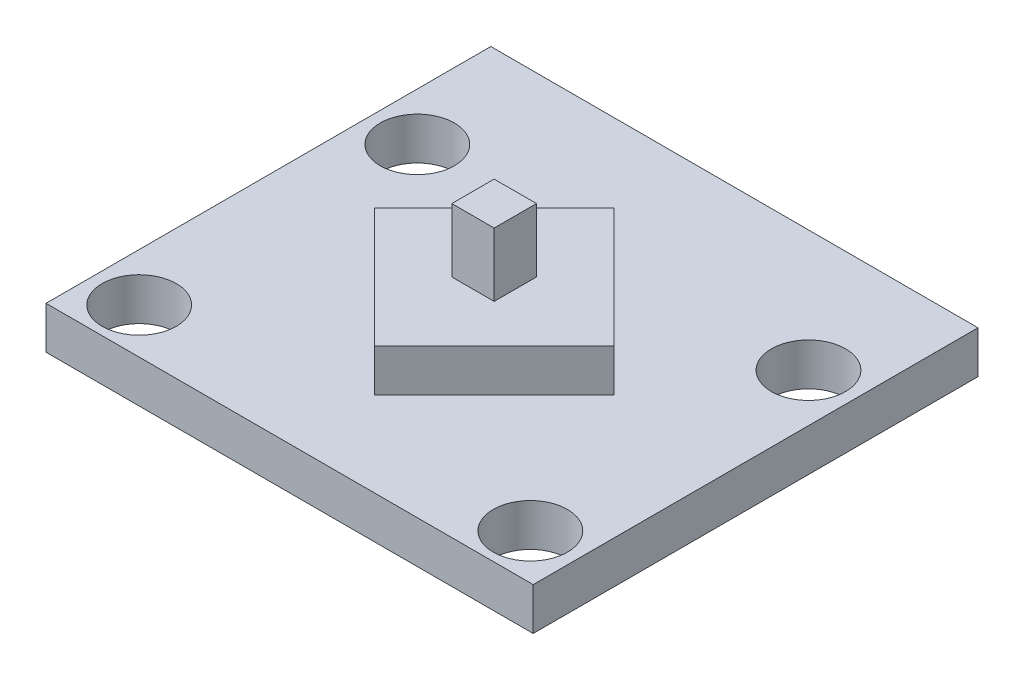
from build123d import *

# Parameters (mm, degrees)
SKETCH1_W           = 23
SKETCH1_H           = 21
BOSS_EXTRUDE1_DEPTH = 2
SKETCH2_R           = 1.75
CUT_EXTRUDE1_DEPTH  = 16.700318468
BOSS_EXTRUDE2_DEPTH = 2
SKETCH4_W           = 2
SKETCH4_H           = 2
BOSS_EXTRUDE3_DEPTH = 3


with BuildPart() as part:
    # Sketch1 → Boss-Extrude1 (new body)
    with BuildSketch(Plane(origin=(0, 0, 0), x_dir=(1, 0, 0), z_dir=(0, 1, 0))):
        Rectangle(SKETCH1_W, SKETCH1_H)
    extrude(amount=BOSS_EXTRUDE1_DEPTH)

    # Sketch2 → Cut-Extrude1 (cut, through all)
    with BuildSketch(Plane(origin=(0, 2, 0), x_dir=(1, 0, 0), z_dir=(0, 1, 0))):
        with Locations(Location((-9.233302989, -8.367680834, 0), (0, 0, 270))):
            Circle(SKETCH2_R)
        with Locations(Location((9.233302989, -8.367680834, 0), (0, 0, 270))):
            Circle(SKETCH2_R)
        with Locations(Location((9.233302989, 4.764127862, 0), (0, 0, 270))):
            Circle(SKETCH2_R)
        with Locations(Location((-9.233302989, 4.764127862, 0), (0, 0, 270))):
            Circle(SKETCH2_R)
    extrude(amount=-CUT_EXTRUDE1_DEPTH, mode=Mode.SUBTRACT)

    # Sketch3 → Boss-Extrude2 (add)
    with BuildSketch(Plane(origin=(0, 2, 0), x_dir=(1, 0, 0), z_dir=(0, 1, 0))):
        Polygon((-5.656854249, -0.843145751), (0, -6.5), (5.656854249, -0.843145751), (0, 4.813708499), align=None)
    extrude(amount=BOSS_EXTRUDE2_DEPTH)

    # Sketch4 → Boss-Extrude3 (add)
    with BuildSketch(Plane(origin=(0, 4, 0), x_dir=(1, 0, 0), z_dir=(0, 1, 0))):
        with Locations((0, -0.843145751)):
            Rectangle(SKETCH4_W, SKETCH4_H)
    extrude(amount=BOSS_EXTRUDE3_DEPTH)


solid = part.part
